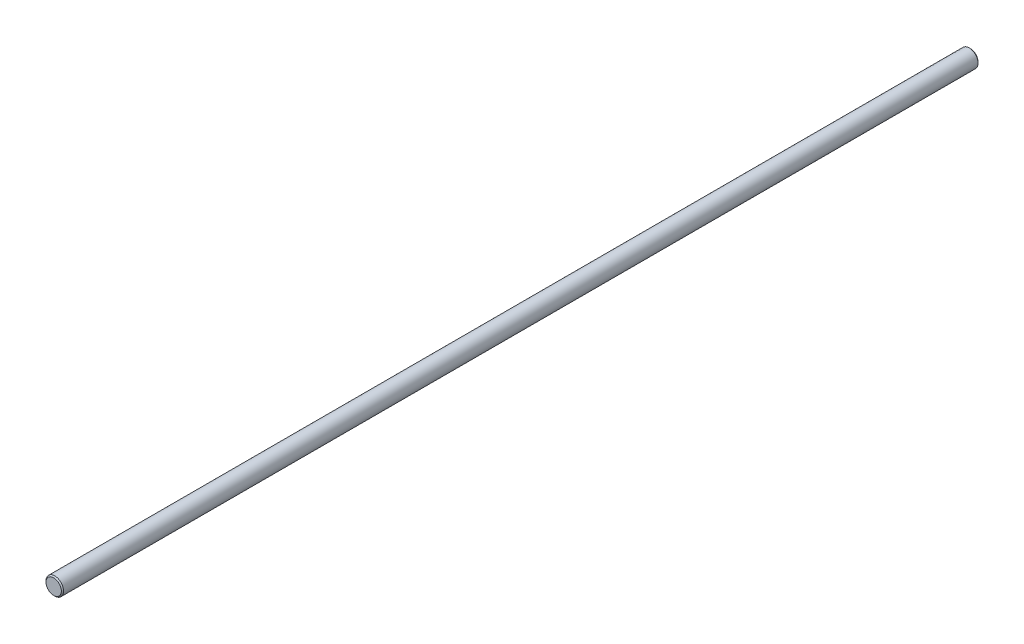
from build123d import *


with BuildPart() as part:
    # Sketch1 → Revolve1 (revolve)
    with BuildSketch(Plane.XZ, mode=Mode.PRIVATE) as revolve1_sk:
        Polygon((3.5, 418), (0, 418), (0, 0), (3.5, 0), (4, 0.5), (4, 417.5), align=None)
    revolve(revolve1_sk.sketch.rotate(Axis((0, 0, 418), (0, 0, -1)), 180), axis=Axis((0, 0, 418), (0, 0, -1)))


solid = part.part
